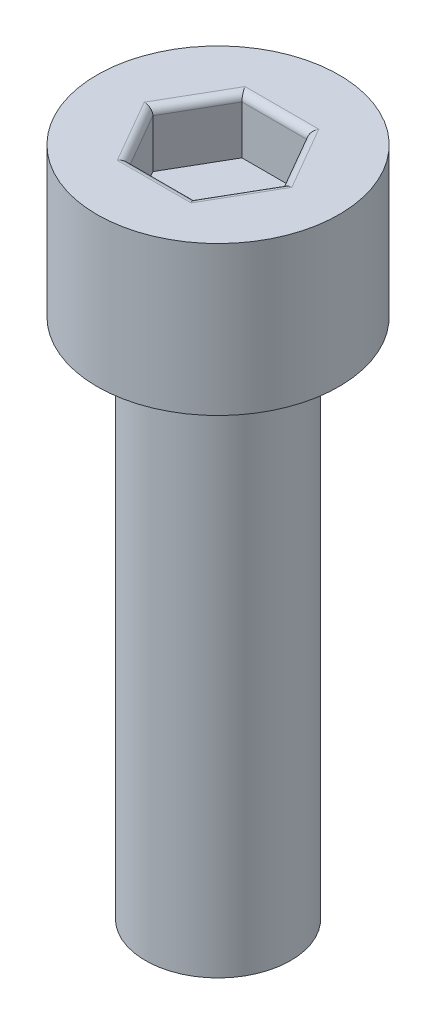
from build123d import *

# Parameters (mm, degrees)
SKETCH_1_R          = 3.25
EXTRUDE_1_DEPTH     = 4
CUT_EXTRUDE_1_DEPTH = 1.5
SKETCH_5_R          = 1.95
EXTRUDE_2_DEPTH     = 14
FILLET_1_R          = 0.2


with BuildPart() as part:
    # 草图1 → 凸台-拉伸1 (new body)
    with BuildSketch(Plane(origin=(0, 0, 0), x_dir=(1, 0, 0), z_dir=(0, 1, 0))):
        with Locations(Location((0, 0, 0), (0, 0, 270))):
            Circle(SKETCH_1_R)
    extrude(amount=EXTRUDE_1_DEPTH)

    # 草图2 → 切除-拉伸1 (cut)
    with BuildSketch(Plane(origin=(0, 4, 0), x_dir=(1, 0, 0), z_dir=(0, 1, 0))):
        Polygon((-0.875, 1.515544457), (0.875, 1.515544457), (1.75, 0), (0.875, -1.515544457), (-0.875, -1.515544457), (-1.75, 0), align=None)
    extrude(amount=-CUT_EXTRUDE_1_DEPTH, mode=Mode.SUBTRACT)

    # 草图5 → 凸台-拉伸2 (add)
    with BuildSketch(Plane.XZ):
        with Locations(Location((0, 0, 0), (0, 0, 270))):
            Circle(SKETCH_5_R)
    extrude(amount=EXTRUDE_2_DEPTH)

    # 圆角1
    fillet_1_edges = [part.edges().sort_by_distance(p)[0] for p in [
        (-1.3125, 4, -0.757772228),
        (0, 4, -1.515544457),
        (1.3125, 4, -0.757772228),
        (1.3125, 4, 0.757772228),
        (0, 4, 1.515544457),
        (-1.3125, 4, 0.757772228),
    ]]
    fillet(fillet_1_edges, radius=FILLET_1_R)


solid = part.part
